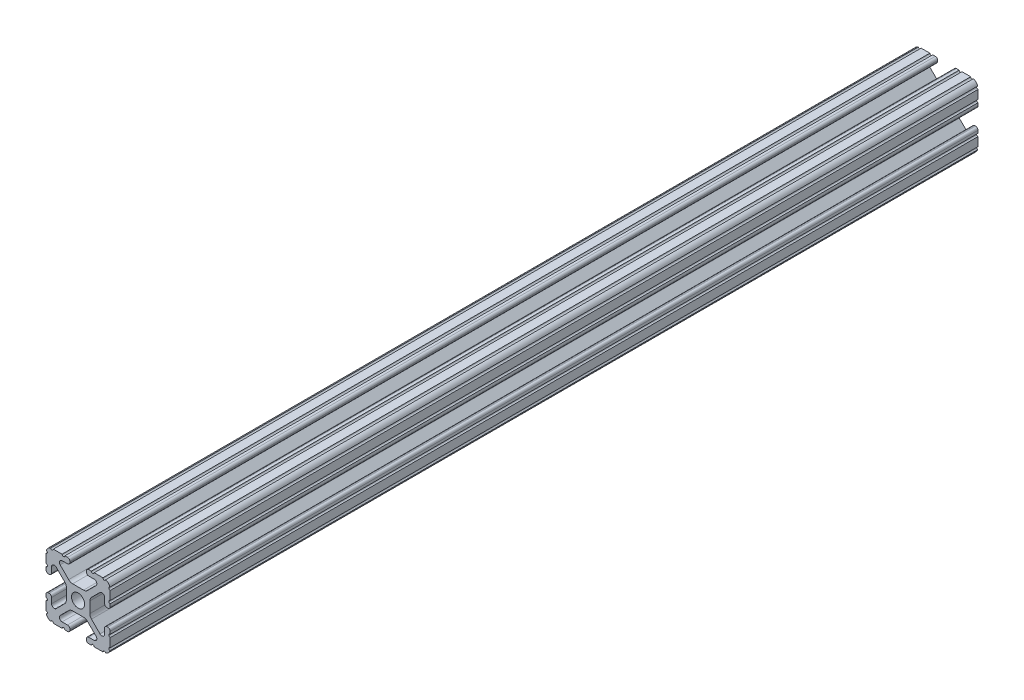
from build123d import *

# Parameters (mm, degrees)
BOSS_EXTRUDE1_START     = -171.699673
BOSS_EXTRUDE1_DEPTH     = 343.399346
CUT_EXTRUDE1_DEPTH      = 173.636490083
CUT_EXTRUDE1_DEPTH_BACK = 173.636490083
SKETCH5_R               = 0.55245


with BuildPart() as part:
    # Sketch4 → Boss-Extrude1 (new body)
    with BuildSketch(Plane.XY.offset(BOSS_EXTRUDE1_START)):
        with BuildLine():
            Line((4.190365, -12.7), (10.11729625, -12.7))
            ThreePointArc((10.11729625, -12.7), (11.943543585, -11.943543585), (12.7, -10.11729625))
            Line((12.7, -10.11729625), (12.7, -4.190365))
            ThreePointArc((12.7, -4.190365), (12.42492494, -3.52627506), (11.760835, -3.2512))
            Line((11.760835, -3.2512), (11.429365, -3.2512))
            ThreePointArc((11.429365, -3.2512), (10.76527506, -3.52627506), (10.4902, -4.190365))
            Line((10.4902, -4.190365), (10.4902, -6.348478019))
            ThreePointArc((10.4902, -6.348478019), (9.830707141, -7.335478831), (8.666460301, -7.103895736))
            Line((8.666460301, -7.103895736), (5.299899128, -3.737334563))
            ThreePointArc((5.299899128, -3.737334563), (4.817571085, -3.015479634), (4.6482, -2.16399369))
            Line((4.6482, -2.16399369), (4.6482, 0))
            Line((4.6482, 0), (2.6035, 0))
            ThreePointArc((2.6035, 0), (1.840952505, -1.840952505), (0, -2.6035))
            Line((0, -2.6035), (0, -4.6482))
            Line((0, -4.6482), (2.16399369, -4.6482))
            ThreePointArc((2.16399369, -4.6482), (3.015479634, -4.817571085), (3.737334563, -5.299899128))
            Line((3.737334563, -5.299899128), (7.103895736, -8.666460301))
            ThreePointArc((7.103895736, -8.666460301), (7.335478831, -9.830707141), (6.348478019, -10.4902))
            Line((6.348478019, -10.4902), (4.190365, -10.4902))
            ThreePointArc((4.190365, -10.4902), (3.52627506, -10.76527506), (3.2512, -11.429365))
            Line((3.2512, -11.429365), (3.2512, -11.760835))
            ThreePointArc((3.2512, -11.760835), (3.52627506, -12.42492494), (4.190365, -12.7))
        make_face()
    extrude(amount=BOSS_EXTRUDE1_DEPTH)

    # Sketch5 → Cut-Extrude1 (cut, two sides: drawn at the far end of the back side and taken through both)
    with BuildSketch(Plane.XY.offset(-CUT_EXTRUDE1_DEPTH_BACK)):
        with Locations((10.356153152, -12.7)):
            Circle(SKETCH5_R)
        with Locations((5.796028019, -12.7)):
            Circle(SKETCH5_R)
        with Locations((12.7, -10.356153152)):
            Circle(SKETCH5_R)
        with Locations((12.7, -5.796028019)):
            Circle(SKETCH5_R)
    extrude(amount=CUT_EXTRUDE1_DEPTH + CUT_EXTRUDE1_DEPTH_BACK, mode=Mode.SUBTRACT)

    # Mirror1: part across plane


with BuildPart() as part_1:
    add(part.part)
    add(part.part.mirror(Plane(origin=(0, 0, 0), x_dir=(0, 0, 1), z_dir=(1, 0, 0))))

    # Mirror2: part across plane


with BuildPart() as part_2:
    add(part_1.part)
    add(part_1.part.mirror(Plane.ZX))


solid = part_2.part
